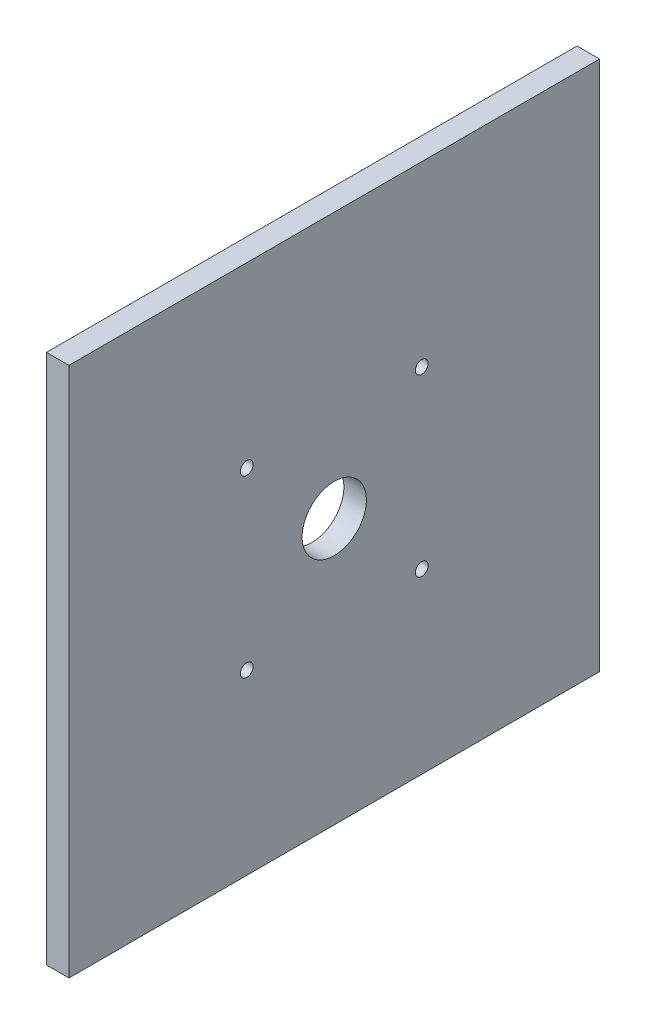
from build123d import *

# Parameters (mm, degrees)
SKETCH1_W           = 33
SKETCH1_H           = 33
SKETCH1_R           = 2
SKETCH1_R_2         = 0.4
BOSS_EXTRUDE1_DEPTH = 1.4


with BuildPart() as part:
    # Sketch1 → Boss-Extrude1 (new body)
    with BuildSketch(Plane(origin=(0, 0, 0), x_dir=(0, 0, -1), z_dir=(1, 0, 0))):
        Rectangle(SKETCH1_W, SKETCH1_H)
        Circle(SKETCH1_R, mode=Mode.SUBTRACT)
        with Locations((5.441459355, -5.441459355)):
            Circle(SKETCH1_R_2, mode=Mode.SUBTRACT)
        with Locations((-5.441459355, -5.441459355)):
            Circle(SKETCH1_R_2, mode=Mode.SUBTRACT)
        with Locations((-5.441459355, 5.441459355)):
            Circle(SKETCH1_R_2, mode=Mode.SUBTRACT)
        with Locations((5.441459355, 5.441459355)):
            Circle(SKETCH1_R_2, mode=Mode.SUBTRACT)
    extrude(amount=BOSS_EXTRUDE1_DEPTH)


solid = part.part
